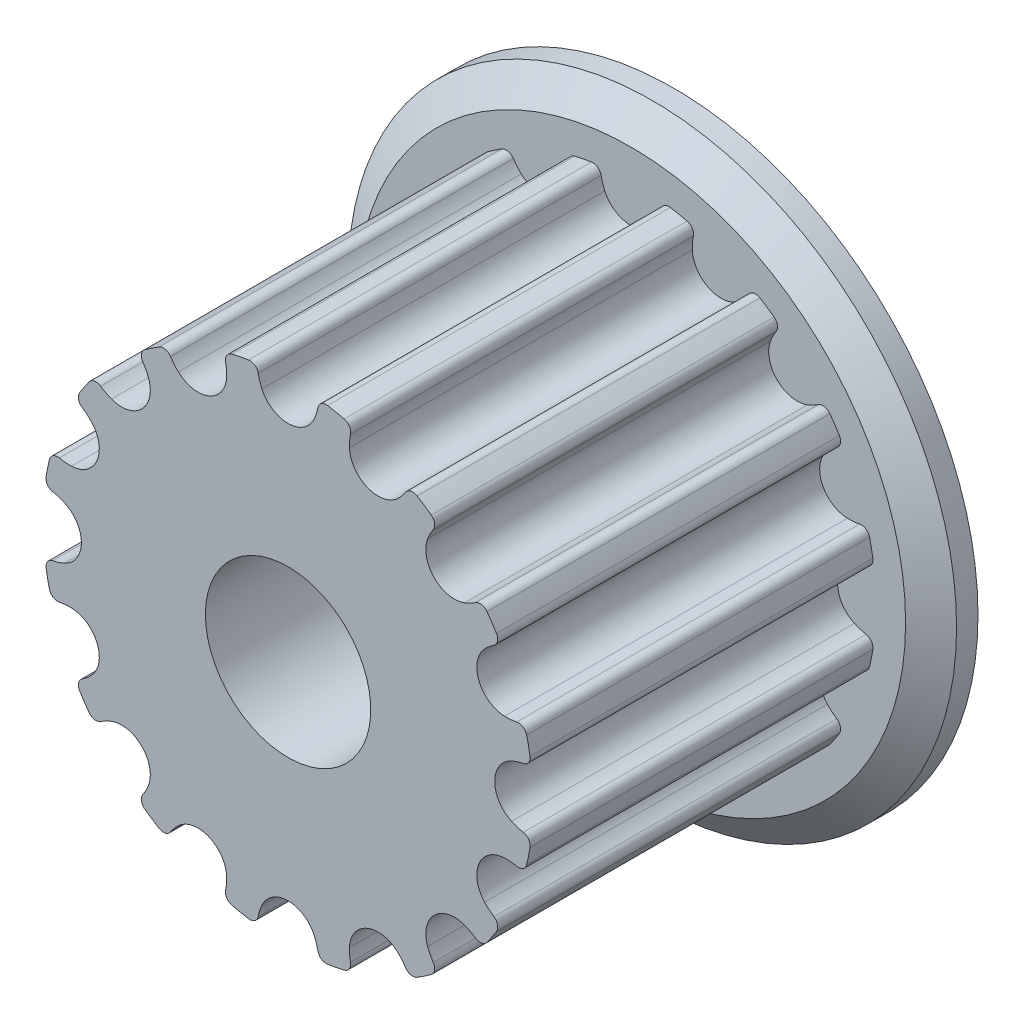
from build123d import *

# Parameters (mm, degrees)
CUT_EXTRUDE1_START = 2.655
CUT_EXTRUDE1_DEPTH = 10.16
CIRPATTERN1_COUNT  = 16
SKETCH4_R          = 1.7526
CUT_EXTRUDE2_DEPTH = 16.477114557
CUT_EXTRUDE3_DEPTH = 1.31445
CIRPATTERN3_COUNT  = 2
CIRPATTERN3_ANGLE  = 90
CHAMFER1_SIZE      = 0.28075
CUT_EXTRUDE4_START = -6.12
SKETCH7_R          = 9.015
CUT_EXTRUDE4_DEPTH = 6.12
SKETCH8_R          = 2.45
CUT_EXTRUDE5_DEPTH = 18.122656044


with BuildPart() as part:
    # Sketch2 → Revolve1 (revolve)
    with BuildSketch(Plane(origin=(0, 0, 0), x_dir=(0, 0, -1), z_dir=(1, 0, 0)), mode=Mode.PRIVATE) as revolve1_sk:
        Polygon((-8.775, 2.38125), (8.775, 2.38125), (8.775, 9.015), (8.14, 9.015), (7.505, 8.13975), (7.505, 7.2645), (-2.655, 7.2645), (-2.655, 8.13975), (-3.29, 9.015), (-8.775, 9.015), align=None)
    revolve(revolve1_sk.sketch.rotate(Axis((0, 0, 8.775), (0, 0, -1)), 90), axis=Axis((0, 0, 8.775), (0, 0, -1)))

    # Sketch3 → Cut-Extrude1 (cut)
    with BuildSketch(Plane.XY.offset(CUT_EXTRUDE1_START)):
        with BuildLine():
            Line((3.757926927, 9.015), (-3.757926927, 9.015))
            Line((-3.757926927, 9.015), (-2.795101196, 6.705249403))
            ThreePointArc((-2.795101196, 6.705249403), (-1.995846132, 6.984952288), (-1.169472895, 7.169748489))
            ThreePointArc((-1.169472895, 7.169748489), (-0.985767742, 7.127751824), (-0.883573242, 6.969424355))
            ThreePointArc((-0.883573242, 6.969424355), (-0.839120956, 6.792881518), (-0.773880597, 6.622919538))
            ThreePointArc((-0.773880597, 6.622919538), (0, 6.1245), (0.773880597, 6.622919538))
            ThreePointArc((0.773880597, 6.622919538), (0.839120956, 6.792881518), (0.883573242, 6.969424355))
            ThreePointArc((0.883573242, 6.969424355), (0.985767742, 7.127751824), (1.169472895, 7.169748489))
            ThreePointArc((1.169472895, 7.169748489), (1.995846132, 6.984952288), (2.795101196, 6.705249403))
            Line((2.795101196, 6.705249403), (3.757926927, 9.015))
        make_face()
    cut_extrude1 = extrude(amount=-CUT_EXTRUDE1_DEPTH, mode=Mode.SUBTRACT)

    # CirPattern1: Cut-Extrude1 ×16 about axis
    cirpattern1_axis = Axis((0, 0, 0), (0, 0, 1))
    for i in range(1, CIRPATTERN1_COUNT):
        add(cut_extrude1.rotate(cirpattern1_axis, i * 360 / CIRPATTERN1_COUNT), mode=Mode.SUBTRACT)

    # Sketch4 → Cut-Extrude2 (cut, through all)
    with BuildSketch(Plane(origin=(0, 0, 0), x_dir=(0, -1, 0), z_dir=(1, 0, 0))):
        with Locations(Location((0, -5.715, 0), (0, 0, 270))):
            Circle(SKETCH4_R)
    cut_extrude2 = extrude(amount=CUT_EXTRUDE2_DEPTH, mode=Mode.SUBTRACT)

    # Sketch5 → Revolve2 (revolve)
    with BuildSketch(Plane.XY.offset(5.715), mode=Mode.PRIVATE) as revolve2_sk:
        Polygon((2.38125, -1.3716), (2.38125, 0), (8.842998261, 0), (8.842998261, -1.3716), (8.461998261, -1.7526), (2.76225, -1.7526), align=None)
    revolve2 = revolve(revolve2_sk.sketch.rotate(Axis((2.38125, 0, 5.715), (1, 0, 0)), 270), axis=Axis((2.38125, 0, 5.715), (1, 0, 0)))

    # Sketch6 → Cut-Extrude3 (cut)
    with BuildSketch(Plane(origin=(8.842998261, 5.384140679, 0), x_dir=(0, -1, 0), z_dir=(-1, 0, 0))):
        Polygon((5.384140679, 6.726864082), (4.507840679, 6.220932041), (4.507840679, 5.209067959), (5.384140679, 4.703135918), (6.260440679, 5.209067959), (6.260440679, 6.220932041), align=None)
    cut_extrude3 = extrude(amount=CUT_EXTRUDE3_DEPTH, mode=Mode.SUBTRACT)

    # CirPattern3: Cut-Extrude2, Revolve2, Cut-Extrude3 ×2 about axis
    cirpattern3_axis = Axis((0, 0, 0), (0, 0, 1))
    add([cut_extrude2.rotate(cirpattern3_axis, i * CIRPATTERN3_ANGLE / (CIRPATTERN3_COUNT - 1)) for i in range(1, CIRPATTERN3_COUNT)], mode=Mode.SUBTRACT)
    add([revolve2.rotate(cirpattern3_axis, i * CIRPATTERN3_ANGLE / (CIRPATTERN3_COUNT - 1)) for i in range(1, CIRPATTERN3_COUNT)])
    add([cut_extrude3.rotate(cirpattern3_axis, i * CIRPATTERN3_ANGLE / (CIRPATTERN3_COUNT - 1)) for i in range(1, CIRPATTERN3_COUNT)], mode=Mode.SUBTRACT)

    # Chamfer1
    chamfer1_edges = [part.edges().sort_by_distance(p)[0] for p in [
        (-2.38125, 0, 8.775),
        (-9.015, 0, 8.775),
    ]]
    chamfer(chamfer1_edges, length=CHAMFER1_SIZE)

    # Sketch7 → Cut-Extrude4 (cut)
    with BuildSketch(Plane.XY.offset(8.775).offset(CUT_EXTRUDE4_START)):
        Circle(SKETCH7_R)
    extrude(amount=CUT_EXTRUDE4_DEPTH, mode=Mode.SUBTRACT)

    # Sketch8 → Cut-Extrude5 (cut, through all)
    with BuildSketch(Plane(origin=(0, 0, -8.775), x_dir=(-1, 0, 0), z_dir=(0, 0, -1))):
        Circle(SKETCH8_R)
    extrude(amount=-CUT_EXTRUDE5_DEPTH, mode=Mode.SUBTRACT)


solid = part.part
